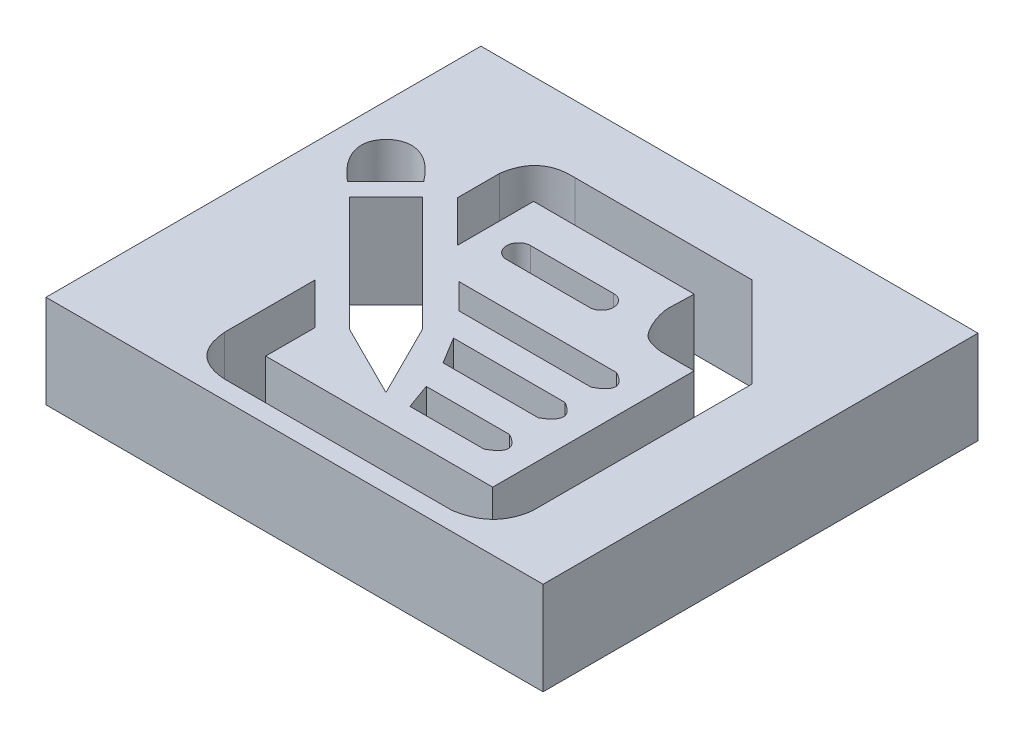
from build123d import *

# Parameters (mm, degrees)
SKETCH2_W           = 16
SKETCH2_H           = 14
BOSS_EXTRUDE1_DEPTH = 3
CUT_EXTRUDE1_DEPTH  = 3


with BuildPart() as part:
    # Sketch2 → Boss-Extrude1 (new body)
    with BuildSketch(Plane(origin=(0, 0, 0), x_dir=(1, 0, 0), z_dir=(0, 1, 0))):
        with Locations((-34.802547771, 15.318471338)):
            Rectangle(SKETCH2_W, SKETCH2_H)
    extrude(amount=BOSS_EXTRUDE1_DEPTH)

    # Sketch4 → Cut-Extrude1 (cut)
    with BuildSketch(Plane(origin=(0, 3, 0), x_dir=(1, 0, 0), z_dir=(0, 1, 0))):
        with BuildLine():
            Line((-41.175596086, 16.394868254), (-39.947814065, 17.622650274))
            add(Edge.make_bspline(
                [(-39.947814065, 17.622650274), (-40.733462487, 18.672629006), (-42.096388691, 18.405416924), (-42.100834752, 17.17324364), (-41.175596086, 16.394868254)],
                knots=[0, 0, 0, 0, 0.504616072, 1, 1, 1, 1], degree=3))
        make_face()
        Polygon((-39.530720652, 17.17030953), (-40.711506231, 15.989523951), (-37.03990928, 12.317927), (-34.675400844, 11.134204143), (-35.857655062, 13.500181218), align=None)
        with BuildLine():
            Line((-38.95501425, 17.722517711), (-37.627364793, 16.394868254))
            Line((-37.627364793, 16.394868254), (-37.627364793, 18.838683184))
            Line((-37.627364793, 18.838683184), (-32.457756286, 18.838683184))
            add(Edge.make_bspline(
                [(-31.400336364, 16.70034512), (-31.826000229, 16.759057378), (-32.15711446, 16.931909426), (-32.563281875, 17.99135722), (-32.457756286, 18.251227672), (-32.457756286, 18.838683184)],
                knots=[0, 0, 0, 0, 0.30144592, 0.621249631, 1, 1, 1, 1], degree=3))
            Line((-31.400336364, 16.70034512), (-30.319418222, 16.70034512))
            Line((-30.319418222, 16.70034512), (-30.319418222, 10.214836266))
            Line((-30.319418222, 10.214836266), (-37.627364793, 10.214836266))
            Line((-37.627364793, 10.214836266), (-37.627364793, 11.800966149))
            Line((-37.627364793, 11.800966149), (-38.95501425, 13.128615607))
            Line((-38.95501425, 13.128615607), (-38.95501425, 10.214836266))
            add(Edge.make_bspline(
                [(-38.95501425, 10.214836266), (-38.855731917, 8.974442118), (-37.627364793, 8.91068503)],
                knots=[0, 0, 0, 1, 1, 1], degree=2))
            Line((-37.627364793, 8.91068503), (-30.319418222, 8.91068503))
            add(Edge.make_bspline(
                [(-30.319418222, 8.91068503), (-29.146746319, 9.095747861), (-29.02114154, 10.214836266)],
                knots=[0, 0, 0, 1, 1, 1], degree=2))
            Line((-29.02114154, 10.214836266), (-29.02114154, 17.258427857))
            Line((-29.02114154, 17.258427857), (-31.929046325, 20.166332642))
            Line((-31.929046325, 20.166332642), (-37.627364793, 20.166332642))
            add(Edge.make_bspline(
                [(-37.627364793, 20.166332642), (-38.792973527, 20.218288166), (-38.95501425, 19.073665389)],
                knots=[0, 0, 0, 1, 1, 1], degree=2))
            Line((-38.95501425, 19.073665389), (-38.95501425, 17.722517711))
        make_face()
        with BuildLine():
            Line((-36.440704658, 17.558030168), (-33.773656633, 17.558030168))
            ThreePointArc((-33.773656633, 17.558030168), (-33.385935995, 17.17030953), (-33.773656633, 16.782588892))
            Line((-33.773656633, 16.782588892), (-36.440704658, 16.782588892))
            ThreePointArc((-36.440704658, 16.782588892), (-36.828425296, 17.17030953), (-36.440704658, 17.558030168))
        make_face()
        with BuildLine():
            Line((-31.517827466, 14.585505277), (-35.782754484, 14.585505277))
            Line((-35.782754484, 14.585505277), (-36.599317646, 15.402068438))
            Line((-36.599317646, 15.402068438), (-31.517827466, 15.402068438))
            add(Edge.make_bspline(
                [(-31.517827466, 14.585505277), (-30.765884411, 14.993786858), (-31.517827466, 15.402068438)],
                knots=[0, 0, 0, 1, 1, 1], degree=2))
        make_face()
        with BuildLine():
            Line((-31.517827466, 13.739569339), (-35.107180646, 13.739569339))
            Line((-35.107180646, 13.739569339), (-34.58434524, 12.881884291))
            Line((-34.58434524, 12.881884291), (-31.517827466, 12.881884291))
            add(Edge.make_bspline(
                [(-31.517827466, 12.881884291), (-30.765884411, 13.310726815), (-31.517827466, 13.739569339)],
                knots=[0, 0, 0, 1, 1, 1], degree=2))
        make_face()
        with BuildLine():
            Line((-31.517827466, 11.953704582), (-34.196624602, 11.953704582))
            Line((-34.196624602, 11.953704582), (-33.902896846, 11.134204143))
            Line((-33.902896846, 11.134204143), (-31.517827466, 11.134204143))
            add(Edge.make_bspline(
                [(-31.517827466, 11.134204143), (-30.765744911, 11.553356024), (-31.517827466, 11.953704582)],
                knots=[0, 0, 0, 1, 1, 1], degree=2))
        make_face()
    extrude(amount=-CUT_EXTRUDE1_DEPTH, mode=Mode.SUBTRACT)


solid = part.part
